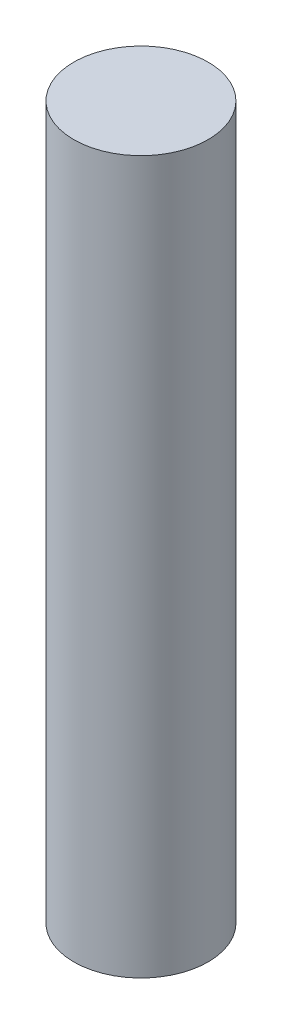
from build123d import *

# Parameters (mm, degrees)
SKETCH_1_R      = 1.415
EXTRUDE_2_DEPTH = 15


with BuildPart() as part:
    # 草图1 → 凸台-拉伸2 (new body)
    with BuildSketch(Plane(origin=(0, 0, 0), x_dir=(1, 0, 0), z_dir=(0, 1, 0))):
        with Locations(Location((0, 0, 0), (0, 0, 270))):
            Circle(SKETCH_1_R)
    extrude(amount=EXTRUDE_2_DEPTH)


solid = part.part
